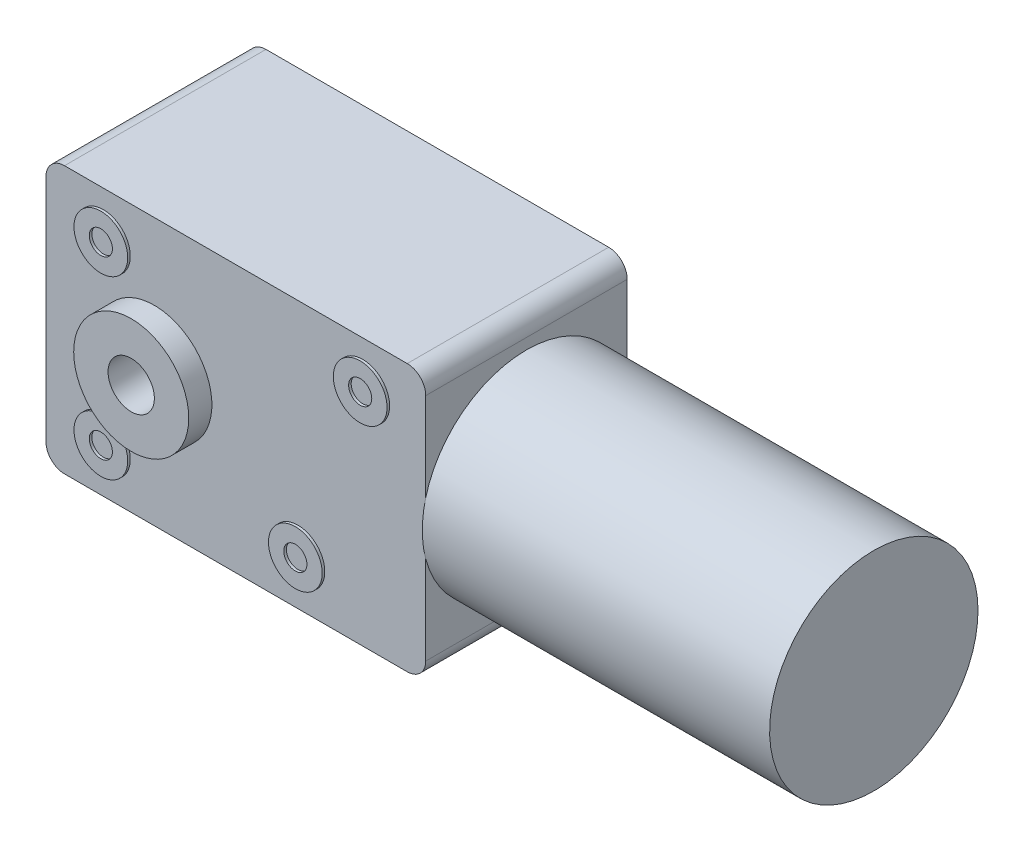
from build123d import *

# Parameters (mm, degrees)
EXTRUDE_1_DEPTH     = 43.5
SKETCH_3_R          = 5.8
SKETCH_3_R_2        = 2.5
EXTRUDE_2_DEPTH     = 0.557471264
SKETCH_3_3_R        = 12.42
SKETCH_3_3_R_2      = 5
EXTRUDE_3_DEPTH     = 5
SKETCH_4_R          = 22.5
EXTRUDE_4_DEPTH     = 75
CUT_EXTRUDE_START   = -10
SKETCH_3_4_R        = 5
CUT_EXTRUDE_1_DEPTH = 10


with BuildPart() as part:
    # 스케치2 → 보스-돌출1 (new body)
    with BuildSketch(Plane.XY):
        with BuildLine():
            Line((-37, 28.82), (37, 28.82))
            ThreePointArc((37, 28.82), (39.828427125, 27.648427125), (41, 24.82))
            Line((41, 24.82), (41, -24.82))
            ThreePointArc((41, -24.82), (39.828427125, -27.648427125), (37, -28.82))
            Line((37, -28.82), (-37, -28.82))
            ThreePointArc((-37, -28.82), (-39.828427125, -27.648427125), (-41, -24.82))
            Line((-41, -24.82), (-41, 24.82))
            ThreePointArc((-41, 24.82), (-39.828427125, 27.648427125), (-37, 28.82))
        make_face()
    extrude(amount=EXTRUDE_1_DEPTH)

    # 스케치3 → 보스-돌출2 (add)
    # profile 1 of 4: a face of its own
    with BuildSketch(Plane.XY.offset(43.5)):
        with Locations((-28.6, 19)):
            Circle(SKETCH_3_R)
        with Locations((-28.6, 19)):
            Circle(SKETCH_3_R_2, mode=Mode.SUBTRACT)
    # profile 2 of 4: a face of its own
    with BuildSketch(Plane.XY.offset(43.5)):
        with Locations((-28.6, -19)):
            Circle(SKETCH_3_R)
        with Locations((-28.6, -19)):
            Circle(SKETCH_3_R_2, mode=Mode.SUBTRACT)
    # profile 3 of 4: a face of its own
    with BuildSketch(Plane.XY.offset(43.5)):
        with Locations((27.4, 19)):
            Circle(SKETCH_3_R)
        with Locations((27.4, 19)):
            Circle(SKETCH_3_R_2, mode=Mode.SUBTRACT)
    # profile 4 of 4: a face of its own
    with BuildSketch(Plane.XY.offset(43.5)):
        with Locations((13.4, -19)):
            Circle(SKETCH_3_R)
        with Locations((13.4, -19)):
            Circle(SKETCH_3_R_2, mode=Mode.SUBTRACT)
    extrude(amount=EXTRUDE_2_DEPTH)

    # 스케치3<3> → 보스-돌출3 (add)
    with BuildSketch(Plane.XY.offset(43.5)):
        with Locations((-17.6, 0)):
            Circle(SKETCH_3_3_R)
        with Locations((-17.6, 0)):
            Circle(SKETCH_3_3_R_2, mode=Mode.SUBTRACT)
    extrude(amount=EXTRUDE_3_DEPTH)

    # 스케치4 → 보스-돌출4 (add)
    with BuildSketch(Plane(origin=(41, 0, 0), x_dir=(0, 0, -1), z_dir=(1, 0, 0))):
        with Locations((-21.75, 0)):
            Circle(SKETCH_4_R)
    extrude(amount=EXTRUDE_4_DEPTH)

    # 스케치3<4> → 컷-돌출1 (cut)
    with BuildSketch(Plane.XY.offset(43.5).offset(CUT_EXTRUDE_START)):
        with Locations((-17.6, 0)):
            Circle(SKETCH_3_4_R)
    extrude(amount=CUT_EXTRUDE_1_DEPTH, mode=Mode.SUBTRACT)


solid = part.part
